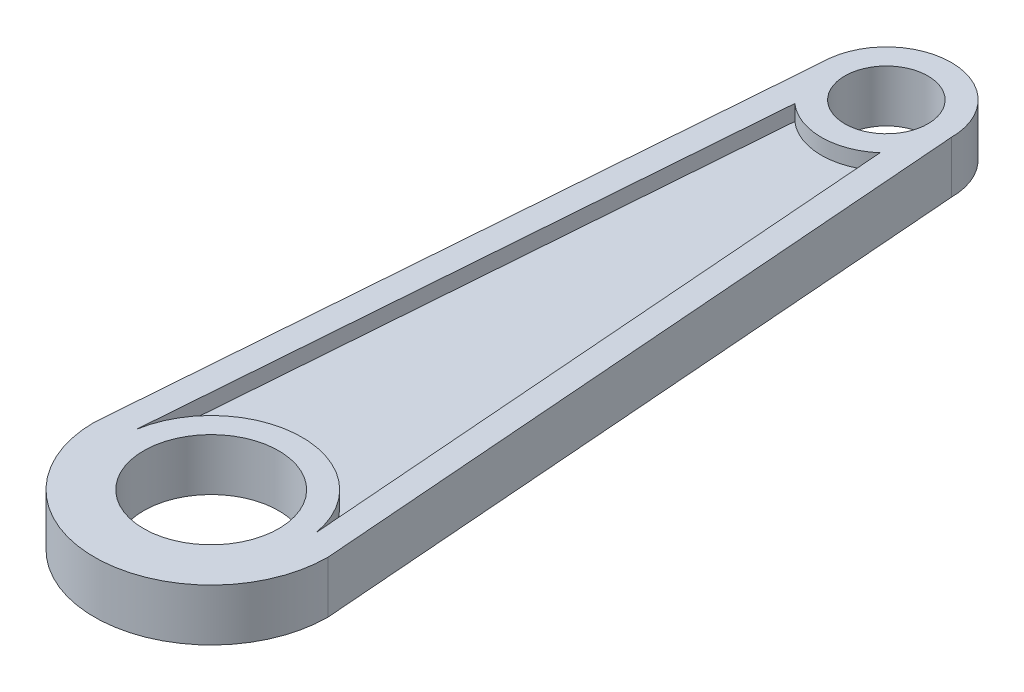
from build123d import *

# Parameters (mm, degrees)
SKETCH1_R           = 13
SKETCH1_R_2         = 8
BOSS_EXTRUDE1_DEPTH = 5
CUT_EXTRUDE1_START  = -5
CUT_EXTRUDE1_DEPTH  = 3
CUT_EXTRUDE2_START  = 2
CUT_EXTRUDE2_DEPTH  = 3


with BuildPart() as part:
    # Sketch1 → Boss-Extrude1 (new, symmetric)
    with BuildSketch(Plane(origin=(0, 0, 0), x_dir=(1, 0, 0), z_dir=(0, 1, 0))):
        with BuildLine():
            Line((22.5, 0), (12.5, 130))
            ThreePointArc((12.5, 130), (0, 142.5), (-12.5, 130))
            Line((-12.5, 130), (-22.5, 0))
            ThreePointArc((-22.5, 0), (0, -22.5), (22.5, 0))
        make_face()
        with Locations(Location((0, 0, 0), (0, 0, 270))):
            Circle(SKETCH1_R, mode=Mode.SUBTRACT)
        with Locations(Location((0, 130, 0), (0, 0, 270))):
            Circle(SKETCH1_R_2, mode=Mode.SUBTRACT)
    extrude(amount=BOSS_EXTRUDE1_DEPTH, both=True)

    # Sketch2 → Cut-Extrude1 (cut)
    with BuildSketch(Plane(origin=(0, 0, 0), x_dir=(1, 0, 0), z_dir=(0, 1, 0)).offset(CUT_EXTRUDE1_START)):
        with BuildLine():
            Line((-8.210272961, 120.57442745), (-17.265674906, 2.854202174))
            ThreePointArc((-17.265674906, 2.854202174), (0, 17.5), (17.265674906, 2.854202174))
            Line((17.265674906, 2.854202174), (8.210272961, 120.57442745))
            ThreePointArc((8.210272961, 120.57442745), (0, 117.5), (-8.210272961, 120.57442745))
        make_face()
    extrude(amount=CUT_EXTRUDE1_DEPTH, mode=Mode.SUBTRACT)

    # Sketch2<3> → Cut-Extrude2 (cut)
    with BuildSketch(Plane(origin=(0, 0, 0), x_dir=(1, 0, 0), z_dir=(0, 1, 0)).offset(CUT_EXTRUDE2_START)):
        with BuildLine():
            Line((-8.210272961, 120.57442745), (-17.265674906, 2.854202174))
            ThreePointArc((-17.265674906, 2.854202174), (0, 17.5), (17.265674906, 2.854202174))
            Line((17.265674906, 2.854202174), (8.210272961, 120.57442745))
            ThreePointArc((8.210272961, 120.57442745), (0, 117.5), (-8.210272961, 120.57442745))
        make_face()
    extrude(amount=CUT_EXTRUDE2_DEPTH, mode=Mode.SUBTRACT)


solid = part.part
